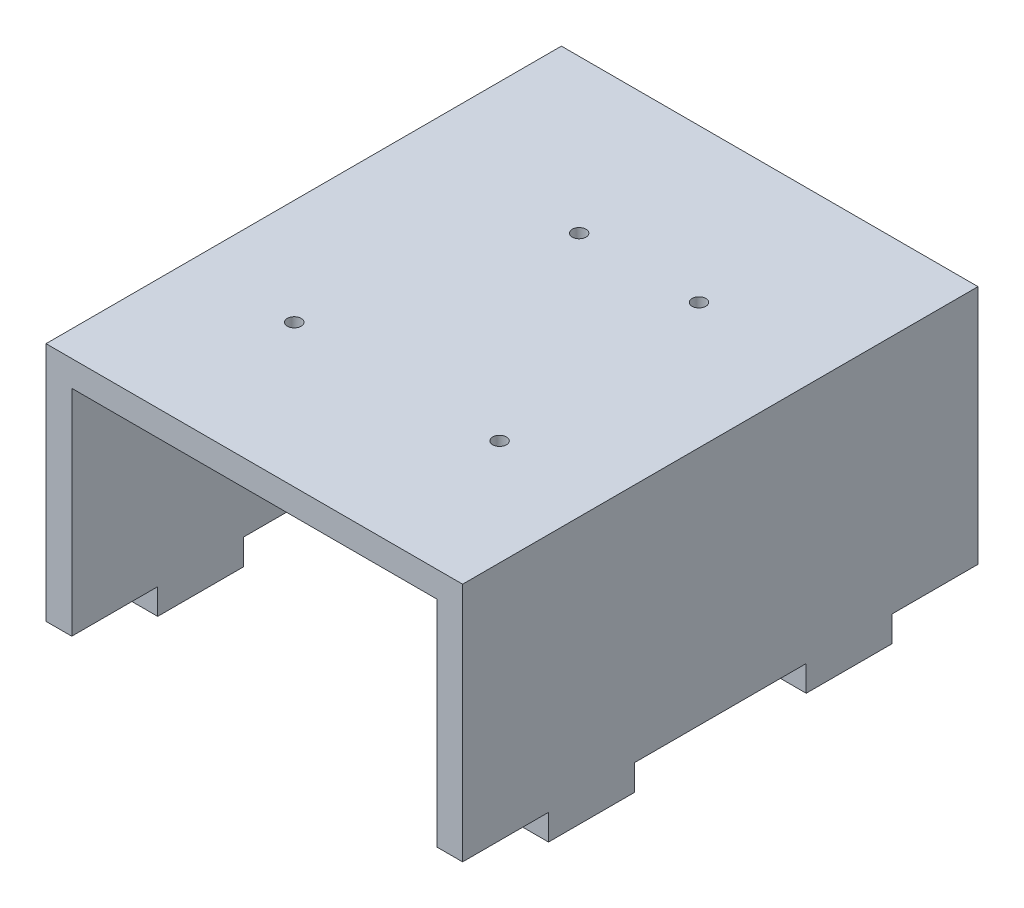
from build123d import *

# Parameters (mm, degrees)
BOSS_EXTRUDE1_DEPTH = 120
SKETCH2_W           = 20
SKETCH2_H           = 6
BOSS_EXTRUDE2_DEPTH = 6
SKETCH3_W           = 20
SKETCH3_H           = 6
BOSS_EXTRUDE3_DEPTH = 6
SKETCH4_R           = 1.6
CUT_EXTRUDE1_DEPTH  = 10


with BuildPart() as part:
    # Sketch1 → Boss-Extrude1 (new body)
    with BuildSketch(Plane.XY):
        Polygon((42.5, 0), (42.5, 50), (-42.5, 50), (-42.5, 0), (-48.5, 0), (-48.5, 56), (48.5, 56), (48.5, 0), align=None)
    extrude(amount=BOSS_EXTRUDE1_DEPTH)

    # Sketch2 → Boss-Extrude2 (add)
    with BuildSketch(Plane(origin=(48.5, 0, 0), x_dir=(0, 0, -1), z_dir=(1, 0, 0))):
        with Locations((-90, -3)):
            Rectangle(SKETCH2_W, SKETCH2_H)
        with Locations((-30, -3)):
            Rectangle(SKETCH2_W, SKETCH2_H)
    extrude(amount=-BOSS_EXTRUDE2_DEPTH)

    # Sketch3 → Boss-Extrude3 (add)
    with BuildSketch(Plane.ZY.offset(48.5)):
        with Locations((30, -3)):
            Rectangle(SKETCH3_W, SKETCH3_H)
        with Locations((90, -3)):
            Rectangle(SKETCH3_W, SKETCH3_H)
    extrude(amount=-BOSS_EXTRUDE3_DEPTH)

    # Sketch4 → Cut-Extrude1 (cut)
    with BuildSketch(Plane(origin=(0, 56, 0), x_dir=(1, 0, 0), z_dir=(0, 1, 0))):
        with Locations(Location((-23.905, -86.79842215, 0), (0, 0, 270))):
            Circle(SKETCH4_R)
        with Locations(Location((23.905, -86.79842215, 0), (0, 0, 270))):
            Circle(SKETCH4_R)
        with Locations(Location((-8.71, -35.65842215, 0), (0, 0, 270))):
            Circle(SKETCH4_R)
        with Locations(Location((19.19, -35.65842215, 0), (0, 0, 270))):
            Circle(SKETCH4_R)
    extrude(amount=-CUT_EXTRUDE1_DEPTH, mode=Mode.SUBTRACT)


solid = part.part
